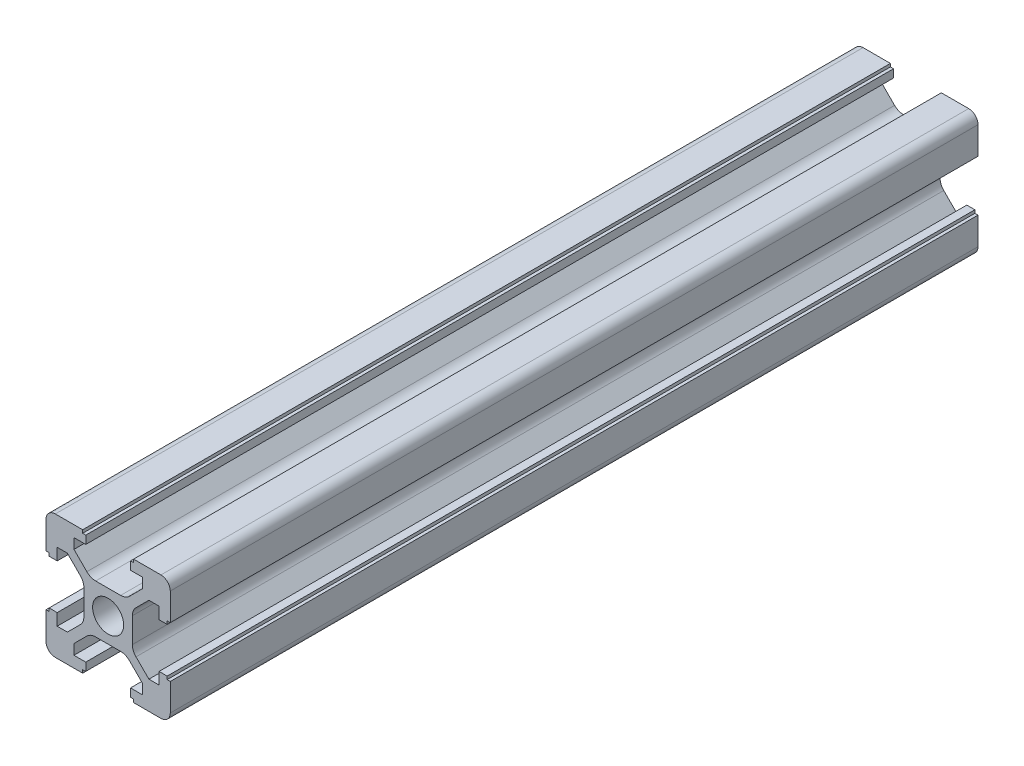
from build123d import *

# Parameters (mm, degrees)
SKETCH1_R           = 2.5
BOSS_EXTRUDE2_DEPTH = 130


with BuildPart() as part:
    # Sketch1 → Boss-Extrude2 (new body)
    with BuildSketch(Plane.XY):
        with BuildLine():
            Line((10, -4.1), (10, -8.5))
            ThreePointArc((10, -8.5), (9.560660172, -9.560660172), (8.5, -10))
            Line((8.5, -10), (4.1, -10))
            Line((4.1, -10), (4.1, -9.5))
            Line((4.1, -9.5), (3.6, -9.5))
            Line((3.6, -9.5), (3.6, -8.2))
            Line((3.6, -8.2), (5.5, -8.2))
            Line((5.5, -8.2), (5.5, -6.560660172))
            Line((5.5, -6.560660172), (3.425126266, -4.485786438))
            ThreePointArc((3.425126266, -4.485786438), (2.776279568, -4.052240935), (2.010912703, -3.9))
            Line((2.010912703, -3.9), (-2.010912703, -3.9))
            ThreePointArc((-2.010912703, -3.9), (-2.776279568, -4.052240935), (-3.425126266, -4.485786438))
            Line((-3.425126266, -4.485786438), (-5.5, -6.560660172))
            Line((-5.5, -6.560660172), (-5.5, -8.2))
            Line((-5.5, -8.2), (-3.6, -8.2))
            Line((-3.6, -8.2), (-3.6, -9.5))
            Line((-3.6, -9.5), (-4.1, -9.5))
            Line((-4.1, -9.5), (-4.1, -10))
            Line((-4.1, -10), (-8.5, -10))
            ThreePointArc((-8.5, -10), (-9.560660172, -9.560660172), (-10, -8.5))
            Line((-10, -8.5), (-10, -4.1))
            Line((-10, -4.1), (-9.5, -4.1))
            Line((-9.5, -4.1), (-9.5, -3.6))
            Line((-9.5, -3.6), (-8.2, -3.6))
            Line((-8.2, -3.6), (-8.2, -5.5))
            Line((-8.2, -5.5), (-6.560660172, -5.5))
            Line((-6.560660172, -5.5), (-4.485786438, -3.425126266))
            ThreePointArc((-4.485786438, -3.425126266), (-4.052240935, -2.776279568), (-3.9, -2.010912703))
            Line((-3.9, -2.010912703), (-3.9, 2.010912703))
            ThreePointArc((-3.9, 2.010912703), (-4.052240935, 2.776279568), (-4.485786438, 3.425126266))
            Line((-4.485786438, 3.425126266), (-6.560660172, 5.5))
            Line((-6.560660172, 5.5), (-8.2, 5.5))
            Line((-8.2, 5.5), (-8.2, 3.6))
            Line((-8.2, 3.6), (-9.5, 3.6))
            Line((-9.5, 3.6), (-9.5, 4.1))
            Line((-9.5, 4.1), (-10, 4.1))
            Line((-10, 4.1), (-10, 8.5))
            ThreePointArc((-10, 8.5), (-9.560660172, 9.560660172), (-8.5, 10))
            Line((-8.5, 10), (-4.1, 10))
            Line((-4.1, 10), (-4.1, 9.5))
            Line((-4.1, 9.5), (-3.6, 9.5))
            Line((-3.6, 9.5), (-3.6, 8.2))
            Line((-3.6, 8.2), (-5.5, 8.2))
            Line((-5.5, 8.2), (-5.5, 6.560660172))
            Line((-5.5, 6.560660172), (-3.425126266, 4.485786438))
            ThreePointArc((-3.425126266, 4.485786438), (-2.776279568, 4.052240935), (-2.010912703, 3.9))
            Line((-2.010912703, 3.9), (2.010912703, 3.9))
            ThreePointArc((2.010912703, 3.9), (2.776279568, 4.052240935), (3.425126266, 4.485786438))
            Line((3.425126266, 4.485786438), (5.5, 6.560660172))
            Line((5.5, 6.560660172), (5.5, 8.2))
            Line((5.5, 8.2), (3.6, 8.2))
            Line((3.6, 8.2), (3.6, 9.5))
            Line((3.6, 9.5), (4.1, 9.5))
            Line((4.1, 9.5), (4.1, 10))
            Line((4.1, 10), (8.5, 10))
            ThreePointArc((8.5, 10), (9.560660172, 9.560660172), (10, 8.5))
            Line((10, 8.5), (10, 4.1))
            Line((10, 4.1), (9.5, 4.1))
            Line((9.5, 4.1), (9.5, 3.6))
            Line((9.5, 3.6), (8.2, 3.6))
            Line((8.2, 3.6), (8.2, 5.5))
            Line((8.2, 5.5), (6.560660172, 5.5))
            Line((6.560660172, 5.5), (4.485786438, 3.425126266))
            ThreePointArc((4.485786438, 3.425126266), (4.052240935, 2.776279568), (3.9, 2.010912703))
            Line((3.9, 2.010912703), (3.9, -2.010912703))
            ThreePointArc((3.9, -2.010912703), (4.052240935, -2.776279568), (4.485786438, -3.425126266))
            Line((4.485786438, -3.425126266), (6.560660172, -5.5))
            Line((6.560660172, -5.5), (8.2, -5.5))
            Line((8.2, -5.5), (8.2, -3.6))
            Line((8.2, -3.6), (9.5, -3.6))
            Line((9.5, -3.6), (9.5, -4.1))
            Line((9.5, -4.1), (10, -4.1))
        make_face()
        Circle(SKETCH1_R, mode=Mode.SUBTRACT)
    extrude(amount=BOSS_EXTRUDE2_DEPTH)


solid = part.part
